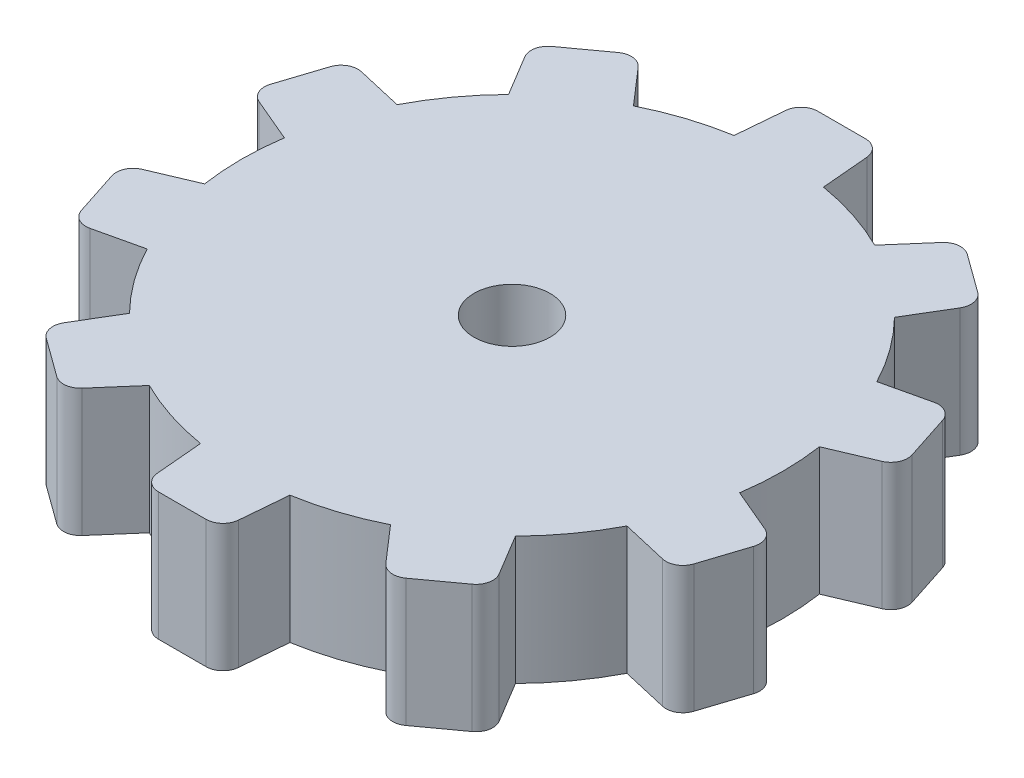
from build123d import *

# Parameters (mm, degrees)
SKETCH1_R           = 16
SKETCH1_R_2         = 2.25
BOSS_EXTRUDE1_DEPTH = 7.55
BOSS_EXTRUDE2_START = -7.55
BOSS_EXTRUDE2_DEPTH = 7.55
CIRPATTERN1_COUNT   = 10


with BuildPart() as part:
    # Sketch1 → Boss-Extrude1 (new body)
    with BuildSketch(Plane(origin=(0, 0, 0), x_dir=(1, 0, 0), z_dir=(0, 1, 0))):
        with Locations(Location((0, 0, 0), (0, 0, 270))):
            Circle(SKETCH1_R)
        with Locations(Location((0, 0, 0), (0, 0, 270))):
            Circle(SKETCH1_R_2, mode=Mode.SUBTRACT)
    extrude(amount=BOSS_EXTRUDE1_DEPTH)

    # Sketch2 → Boss-Extrude2 (add)
    with BuildSketch(Plane(origin=(0, 7.55, 0), x_dir=(1, 0, 0), z_dir=(0, 1, 0)).offset(BOSS_EXTRUDE2_START)):
        with BuildLine():
            Line((-1.403668826, 19.5), (1.403668826, 19.5))
            ThreePointArc((1.403668826, 19.5), (2.079259034, 19.237277337), (2.399863524, 18.587155743))
            Line((2.399863524, 18.587155743), (2.645477092, 15.779779813))
            ThreePointArc((2.645477092, 15.779779813), (0, 16), (-2.645477092, 15.779779813))
            Line((-2.645477092, 15.779779813), (-2.399863524, 18.587155743))
            ThreePointArc((-2.399863524, 18.587155743), (-2.079259034, 19.237277337), (-1.403668826, 19.5))
        make_face()
    boss_extrude2 = extrude(amount=BOSS_EXTRUDE2_DEPTH)

    # CirPattern1: Boss-Extrude2 ×10 about axis
    cirpattern1_axis = Axis((0, 0, 0), (0, 1, 0))
    for i in range(1, CIRPATTERN1_COUNT):
        add(boss_extrude2.rotate(cirpattern1_axis, i * 360 / CIRPATTERN1_COUNT))


solid = part.part
